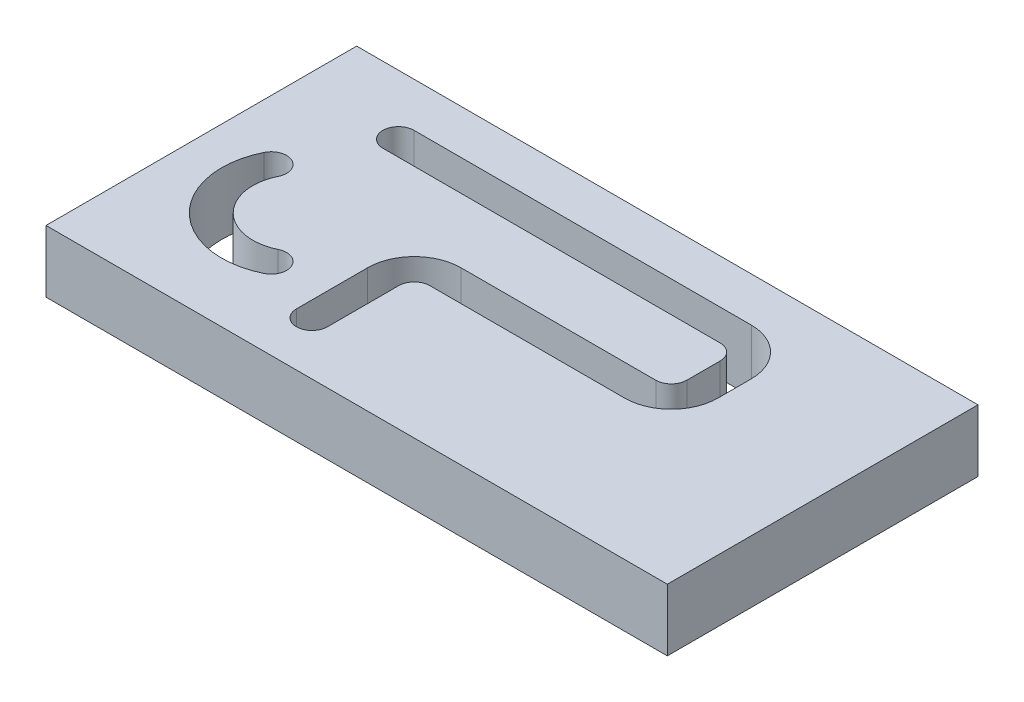
from build123d import *

# Parameters (mm, degrees)
SKETCH1_W           = 254
SKETCH1_H           = 127
BOSS_EXTRUDE1_DEPTH = 25.4
CUT_EXTRUDE2_DEPTH  = 145.244271983
CUT_EXTRUDE3_DEPTH  = 145.244271983


with BuildPart() as part:
    # Sketch1 → Boss-Extrude1 (new body)
    with BuildSketch(Plane(origin=(0, 0, 0), x_dir=(1, 0, 0), z_dir=(0, 1, 0))):
        Rectangle(SKETCH1_W, SKETCH1_H)
    extrude(amount=BOSS_EXTRUDE1_DEPTH)

    # Sketch3 → Cut-Extrude2 (cut, through all)
    with BuildSketch(Plane(origin=(0, 25.4, 0), x_dir=(1, 0, 0), z_dir=(0, 1, 0))):
        with BuildLine():
            Line((-85.466243436, 32.694846332), (52.417137856, 32.694846332))
            ThreePointArc((52.417137856, 32.694846332), (56.907265917, 30.834974392), (58.767137856, 26.344846332))
            Line((58.767137856, 26.344846332), (58.767137856, 12.7))
            ThreePointArc((58.767137856, 12.7), (56.907265917, 8.209871939), (52.417137856, 6.35))
            Line((52.417137856, 6.35), (-27.235119701, 6.35))
            ThreePointArc((-27.235119701, 6.35), (-40.705503883, 0.770384182), (-46.285119701, -12.7))
            Line((-46.285119701, -12.7), (-46.285119701, -41.842848349))
            ThreePointArc((-46.285119701, -41.842848349), (-39.935119701, -48.192848349), (-33.585119701, -41.842848349))
            Line((-33.585119701, -41.842848349), (-33.585119701, -12.7))
            ThreePointArc((-33.585119701, -12.7), (-31.725247761, -8.209871939), (-27.235119701, -6.35))
            Line((-27.235119701, -6.35), (52.417137856, -6.35))
            ThreePointArc((52.417137856, -6.35), (65.887522038, -0.770384182), (71.467137856, 12.7))
            Line((71.467137856, 12.7), (71.467137856, 26.344846332))
            ThreePointArc((71.467137856, 26.344846332), (65.887522038, 39.815230513), (52.417137856, 45.394846332))
            Line((52.417137856, 45.394846332), (-85.466243436, 45.394846332))
            ThreePointArc((-85.466243436, 45.394846332), (-91.816243436, 39.044846332), (-85.466243436, 32.694846332))
        make_face()
    extrude(amount=-CUT_EXTRUDE2_DEPTH, mode=Mode.SUBTRACT)

    # Sketch4 → Cut-Extrude3 (cut, through all)
    with BuildSketch(Plane(origin=(0, 25.4, 0), x_dir=(1, 0, 0), z_dir=(0, 1, 0))):
        with BuildLine():
            ThreePointArc((-108.321717666, 6.889728777), (-102.153470481, -29.786963762), (-65.476777942, -35.955210947))
            ThreePointArc((-65.476777942, -35.955210947), (-62.539282648, -27.468979663), (-71.025513931, -24.531484369))
            ThreePointArc((-71.025513931, -24.531484369), (-93.17321436, -20.806707641), (-96.897991088, 1.340992788))
            ThreePointArc((-96.897991088, 1.340992788), (-99.835486382, 9.827224072), (-108.321717666, 6.889728777))
        make_face()
    extrude(amount=-CUT_EXTRUDE3_DEPTH, mode=Mode.SUBTRACT)


solid = part.part
